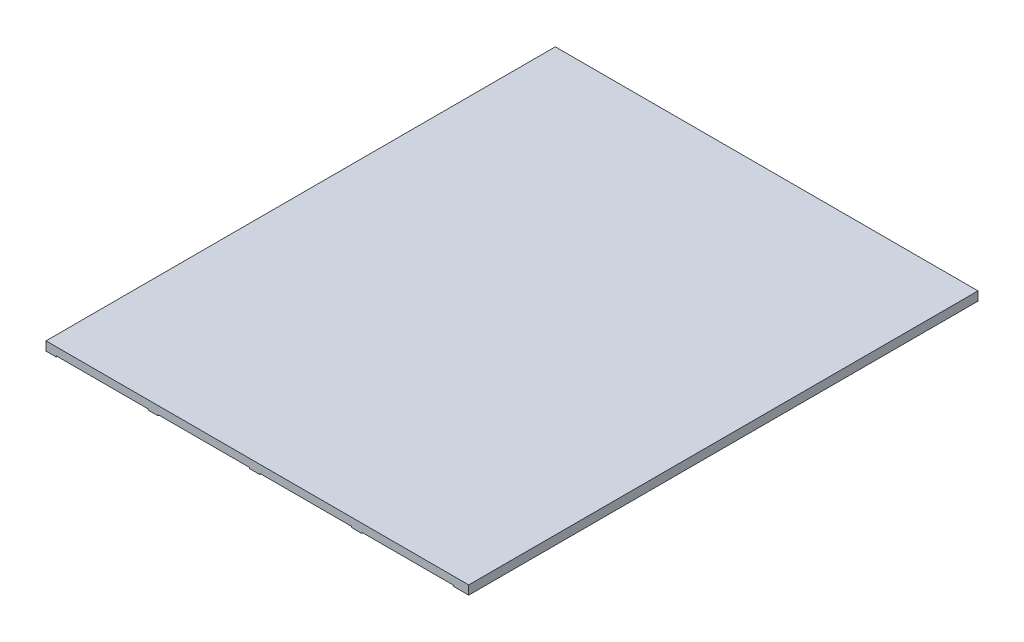
from build123d import *

# Parameters (mm, degrees)
SKETCH2_W            = 83
SKETCH2_H            = 100
BOSS_EXTRUDE1_DEPTH  = 1.75
SKETCH3_W            = 18
SKETCH3_H            = 18
CUT_EXTRUDE5_DEPTH   = 0.2
LPATTERN1_COUNT      = 4
LPATTERN1_PITCH      = 20
LPATTERN1_COUNT_DIR2 = 5
LPATTERN1_PITCH_DIR2 = 20


with BuildPart() as part:
    # Sketch2 → Boss-Extrude1 (new body)
    with BuildSketch(Plane(origin=(0, 0, 0), x_dir=(1, 0, 0), z_dir=(0, 1, 0))):
        Rectangle(SKETCH2_W, SKETCH2_H)
    extrude(amount=BOSS_EXTRUDE1_DEPTH)

    # Sketch3 → Cut-Extrude5 (cut)
    with BuildSketch(Plane(origin=(0, 0, 0), x_dir=(1, 0, 0), z_dir=(0, 1, 0))):
        with Locations((-30.5, 39)):
            Rectangle(SKETCH3_W, SKETCH3_H)
    cut_extrude5 = extrude(amount=CUT_EXTRUDE5_DEPTH, mode=Mode.SUBTRACT)

    # LPattern1: Cut-Extrude5 4 × 5
    with Locations(*[(i * LPATTERN1_PITCH, 0, j * LPATTERN1_PITCH_DIR2) for i in range(LPATTERN1_COUNT) for j in range(LPATTERN1_COUNT_DIR2) if (i, j) != (0, 0)]):
        add(cut_extrude5, mode=Mode.SUBTRACT)


solid = part.part
